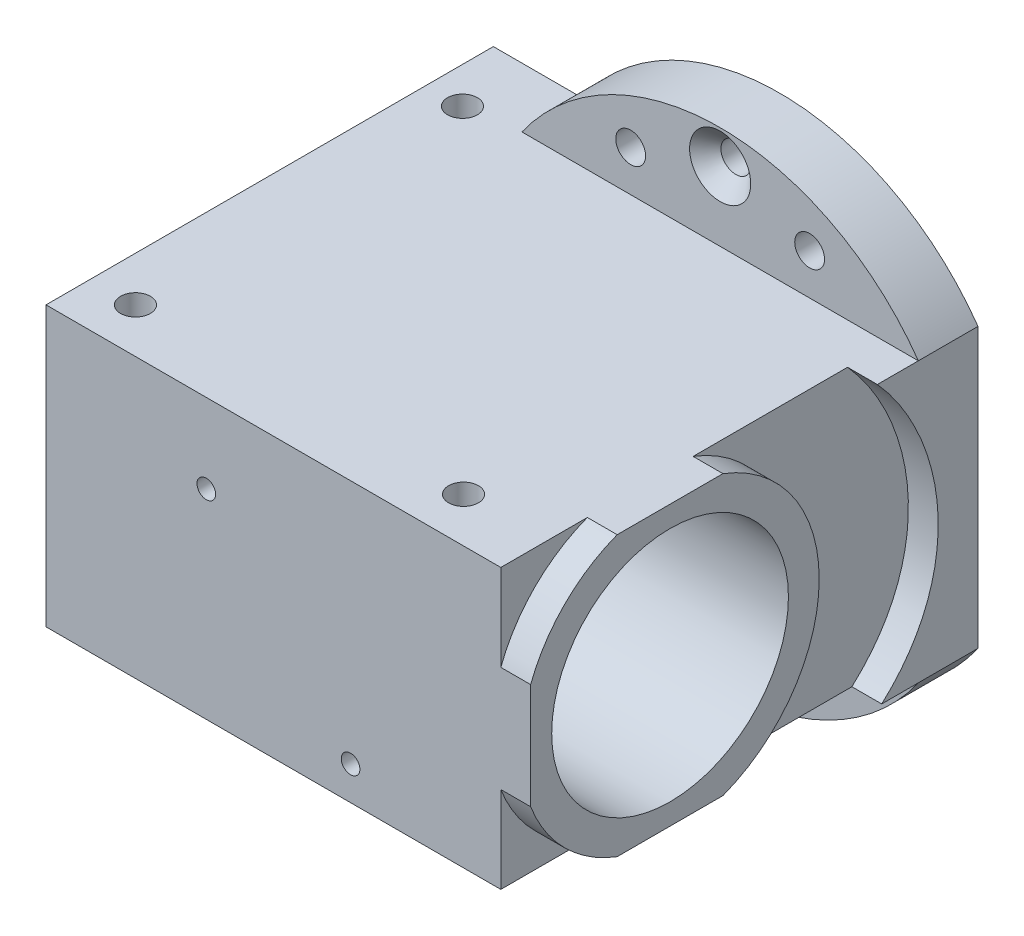
from build123d import *

# Parameters (mm, degrees)
SKETCH1_W                                         = 65
SKETCH1_H                                         = 37.4
BOSS_EXTRUDE1_DEPTH                               = 60
SKETCH2_R                                         = 15.875
CUT_EXTRUDE1_DEPTH                                = 91.41399228
F_1_0MM_DOWEL_HOLE1_D                             = 2.5
F_1_0MM_DOWEL_HOLE1_DEPTH                         = 5
F_1_0MM_DOWEL_HOLE1_TIP                           = 0.751075774
LPATTERN2_COUNT                                   = 2
LPATTERN2_PITCH                                   = 41.9
LPATTERN3_COUNT                                   = 2
LPATTERN3_PITCH                                   = 35.5
SKETCH20_R                                        = 15.875
SKETCH20_R_2                                      = 12.7
BOSS_EXTRUDE6_DEPTH                               = 7
CUT_EXTRUDE2_DEPTH                                = 4
SKETCH24_R                                        = 2
BOSS_EXTRUDE7_DEPTH                               = 8
CSK_FOR_M3_5_FLAT_HEAD_MACHINE_SCREW2_D           = 4
CSK_FOR_M3_5_FLAT_HEAD_MACHINE_SCREW2_CSINK_D     = 8.2
CSK_FOR_M3_5_FLAT_HEAD_MACHINE_SCREW2_CSINK_ANGLE = 90
F_4_0MM_DOWEL_HOLE2_D                             = 4
F_4_0MM_DOWEL_HOLE2_DEPTH                         = 4
F_4_0MM_DOWEL_HOLE2_TIP                           = 1.201721238


with BuildPart() as part:
    # Sketch1 → Boss-Extrude1 (new body)
    with BuildSketch(Plane.XY):
        Rectangle(SKETCH1_W, SKETCH1_H)
    extrude(amount=BOSS_EXTRUDE1_DEPTH)

    # Sketch2 → Cut-Extrude1 (cut, through all)
    with BuildSketch(Plane(origin=(32.5, 0, 0), x_dir=(0, 0, -1), z_dir=(1, 0, 0))):
        with Locations((-41.3, 0)):
            Circle(SKETCH2_R)
    extrude(amount=-CUT_EXTRUDE1_DEPTH, mode=Mode.SUBTRACT)

    # Ø1.0mm Dowel Hole1
    with Locations(Plane.XY.offset(60)):
        with Locations((-11, 8.07), (8.35, -14.2)):
            Hole(F_1_0MM_DOWEL_HOLE1_D / 2, depth=F_1_0MM_DOWEL_HOLE1_DEPTH)
            with Locations((0, 0, -(F_1_0MM_DOWEL_HOLE1_DEPTH + F_1_0MM_DOWEL_HOLE1_TIP / 2))):  # 118° drill point
                Cone(0, F_1_0MM_DOWEL_HOLE1_D / 2, F_1_0MM_DOWEL_HOLE1_TIP, mode=Mode.SUBTRACT)

    # Sketch19 → Ø1.0mm Dowel Hole2 (revolve, cut)
    with BuildSketch(Plane(origin=(26.5, -18.7, 54), x_dir=(0, 0, -1), z_dir=(1, 0, 0))):
        Polygon((0, 0), (0, 5.991420021), (1.65, 5), (1.65, 0), align=None)
    f_1_0mm_dowel_hole2 = revolve(axis=Axis((26.5, -25.05, 54), (0, 1, 0)), mode=Mode.SUBTRACT)

    # LPattern2: Ø1.0mm Dowel Hole2 ×2
    with Locations(*[(-i * LPATTERN2_PITCH, 0, 0) for i in range(1, LPATTERN2_COUNT)]):
        add(f_1_0mm_dowel_hole2, mode=Mode.SUBTRACT)

    # LPattern3: Ø1.0mm Dowel Hole2 ×2
    with Locations(*[(0, 0, -i * LPATTERN3_PITCH) for i in range(1, LPATTERN3_COUNT)]):
        add(f_1_0mm_dowel_hole2, mode=Mode.SUBTRACT)

    # Sketch20 → Boss-Extrude6 (add, symmetric)
    with BuildSketch(Plane(origin=(0, 0, 0), x_dir=(0, 0, -1), z_dir=(1, 0, 0))):
        with Locations((-41.3, 0)):
            Circle(SKETCH20_R)
        with Locations((-41.3, 0)):
            Circle(SKETCH20_R_2, mode=Mode.SUBTRACT)
    extrude(amount=BOSS_EXTRUDE6_DEPTH, both=True)

    # Sketch23 → Cut-Extrude2 (cut)
    with BuildSketch(Plane(origin=(32.5, 0, 0), x_dir=(0, 0, -1), z_dir=(1, 0, 0))):
        with BuildLine():
            ThreePointArc((-60, 7.092954251), (-55.442135624, 14.142135624), (-48.392954251, 18.7))
            Line((-48.392954251, 18.7), (-60, 18.7))
            Line((-60, 18.7), (-60, 7.092954251))
        make_face()
        with BuildLine():
            ThreePointArc((-48.392954251, -18.7), (-55.442135624, -14.142135624), (-60, -7.092954251))
            Line((-60, -7.092954251), (-60, -18.7))
            Line((-60, -18.7), (-48.392954251, -18.7))
        make_face()
        with BuildLine():
            Line((-13.497713028, 18.7), (-34.207045749, 18.7))
            ThreePointArc((-34.207045749, 18.7), (-21.3, 0), (-34.207045749, -18.7))
            Line((-34.207045749, -18.7), (-12.913047807, -18.7))
            add(Edge.make_bspline(
                [(-13.497713028, 18.7), (-4.48947297, 8.699685881), (-1.125683448, -8.066606066), (-12.913047807, -18.7)],
                knots=[0, 0, 0, 0, 1, 1, 1, 1], degree=3))
        make_face()
    extrude(amount=-CUT_EXTRUDE2_DEPTH, mode=Mode.SUBTRACT)

    # Sketch24 → Boss-Extrude7 (add)
    # profile 1 of 2: a face of its own
    with BuildSketch(Plane(origin=(0, 0, 0), x_dir=(-1, 0, 0), z_dir=(0, 0, -1))):
        with BuildLine():
            Line((-32.5, -18.7), (20.662392723, -18.7))
            ThreePointArc((20.662392723, -18.7), (-5.918803639, -32.5), (-32.5, -18.7))
        make_face()
        with Locations(Location((6.081196361, -24.2, 0), (0, 0, 180))):
            Circle(SKETCH24_R, mode=Mode.SUBTRACT)
        with Locations(Location((-17.918803639, -24.2, 0), (0, 0, 180))):
            Circle(SKETCH24_R, mode=Mode.SUBTRACT)
    # profile 2 of 2: a face of its own
    with BuildSketch(Plane(origin=(0, 0, 0), x_dir=(-1, 0, 0), z_dir=(0, 0, -1))):
        with BuildLine():
            Line((20.662392723, 18.7), (-32.5, 18.7))
            ThreePointArc((-32.5, 18.7), (-5.918803639, 32.5), (20.662392723, 18.7))
        make_face()
        with Locations((-17.918803639, 24.2)):
            Circle(SKETCH24_R, mode=Mode.SUBTRACT)
        with Locations((6.081196361, 24.2)):
            Circle(SKETCH24_R, mode=Mode.SUBTRACT)
    extrude(amount=-BOSS_EXTRUDE7_DEPTH)

    # CSK for M3.5 Flat Head Machine Screw2 (through all)
    with Locations(Plane.XY.offset(8)):
        with Locations((5.918803639, 28)):
            csk_for_m3_5_flat_head_machine_screw2 = CounterSinkHole(CSK_FOR_M3_5_FLAT_HEAD_MACHINE_SCREW2_D / 2, CSK_FOR_M3_5_FLAT_HEAD_MACHINE_SCREW2_CSINK_D / 2, counter_sink_angle=CSK_FOR_M3_5_FLAT_HEAD_MACHINE_SCREW2_CSINK_ANGLE)

    # Mirror1: CSK for M3.5 Flat Head Machine Screw2 across plane
    add(csk_for_m3_5_flat_head_machine_screw2.mirror(Plane.ZX), mode=Mode.SUBTRACT)

    # Ø4.0mm Dowel Hole2
    with Locations(Plane(origin=(0, 18.7, 0), x_dir=(1, 0, 0), z_dir=(0, 1, 0))):
        with Locations((-26.5, -54), (17.5, -54), (-27.64165215, -9)):
            Hole(F_4_0MM_DOWEL_HOLE2_D / 2, depth=F_4_0MM_DOWEL_HOLE2_DEPTH)
            with Locations((0, 0, -(F_4_0MM_DOWEL_HOLE2_DEPTH + F_4_0MM_DOWEL_HOLE2_TIP / 2))):  # 118° drill point
                Cone(0, F_4_0MM_DOWEL_HOLE2_D / 2, F_4_0MM_DOWEL_HOLE2_TIP, mode=Mode.SUBTRACT)


solid = part.part
